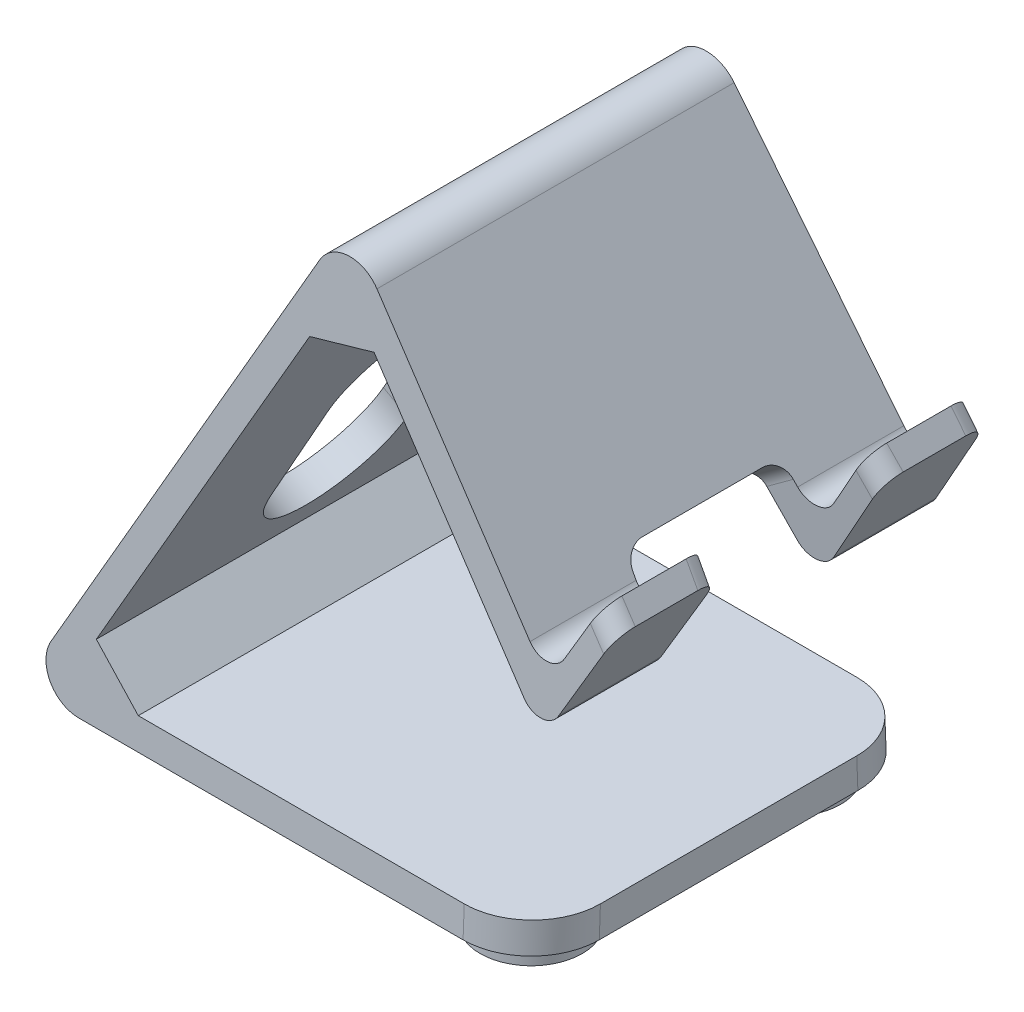
from build123d import *
from OCP.BRepFilletAPI import BRepFilletAPI_MakeChamfer

# Parameters (mm, degrees)
EXTRUDE_1_DEPTH                 = 29
CUT_EXTRUDE_1_DEPTH             = 114.428391508
CUT_EXTRUDE_1_DEPTH_BACK        = 114.428391508
CUT_EXTRUDE_2_REACH             = 120.355
CUT_EXTRUDE_2_DIRECTION_2_DEPTH = 119.355335874
FILLET_2_R                      = 10
CHAMFER_1_SIZE                  = 10
CHAMFER_1_SIZE2                 = 7.55059217
CHAMFER_1_SIZE2_2               = 7.3430239
FILLET_4_R                      = 5
FILLET_5_R                      = 5
FILLET_6_R                      = 3
FILLET_8_R                      = 3
SKETCH_4_R                      = 7.5
EXTRUDE_2_DEPTH                 = 3
CUT_EXTRUDE_3_DEPTH             = 9
CUT_EXTRUDE_4_DEPTH             = 0.3
FILLET_9_R                      = 3


with BuildPart() as part:
    # 草图1 → 凸台-拉伸1 (new, symmetric)
    with BuildSketch(Plane.XY):
        Polygon((0, 0), (-75, 0), (-30, 80), (1, 37.6), (8.5, 50.590381057), (10.565726296, 47.765000574), (0.433642115, 30.215715986), (-30, 71.841084555), (-67.879360062, 4.5), (0, 4.5), align=None)
    extrude(amount=EXTRUDE_1_DEPTH, both=True)

    # 草图2 → 切除-拉伸1 (cut, two sides: drawn at the far end of the back side and taken through both)
    with BuildSketch(Plane(origin=(0, 0, 0), x_dir=(0, 0, -1), z_dir=(1, 0, 0)).offset(-CUT_EXTRUDE_1_DEPTH_BACK)):
        Polygon((-29, 0), (-26, 80), (-29, 80), align=None)
        Polygon((29, 80), (29, 0), (26, 80), align=None)
    extrude(amount=CUT_EXTRUDE_1_DEPTH + CUT_EXTRUDE_1_DEPTH_BACK, mode=Mode.SUBTRACT)

    # 草图3 → 切除-拉伸2 (cut, up to next)
    with BuildSketch(Plane(origin=(18.566022416, 13.574214502, 0), x_dir=(0, 0, -1), z_dir=(0.8072515663768532, 0.5902075131528883, 0)), mode=Mode.PRIVATE) as cut_extrude_2_sk1:
        Polygon((11.5, 38), (-11.5, 38), (-14, 13), (14, 13), align=None)
    cut_extrude_2_tool1 = extrude(cut_extrude_2_sk1.sketch, amount=-CUT_EXTRUDE_2_REACH, mode=Mode.PRIVATE) & part.part
    add(cut_extrude_2_tool1.solids().sort_by_distance((3.756829, 33.82937, 0))[0], mode=Mode.SUBTRACT)

    # 草图3 → 切除-拉伸2 direction 2 (cut)
    with BuildSketch(Plane(origin=(18.566022416, 13.574214502, 0), x_dir=(0, 0, -1), z_dir=(0.8072515663768532, 0.5902075131528883, 0))):
        Polygon((11.5, 38), (-11.5, 38), (-14, 13), (14, 13), align=None)
    extrude(amount=CUT_EXTRUDE_2_DIRECTION_2_DEPTH, mode=Mode.SUBTRACT)

    # 圆角2
    fillet_2_edges = [part.edges().sort_by_distance(p)[0] for p in [
        (0, 2.25, 28.915625),
        (0, 2.25, -28.915625),
    ]]
    fillet(fillet_2_edges, radius=FILLET_2_R)

    # 倒角1: one chamfer whose edges measure the first distance from different faces: ONE call of the kernel's chamfer builder (chamfer() names one face for all edges)
    chamfer_1_edges_1 = [part.edges().sort_by_distance(p)[0] for p in [
        (-30, 71.841084555, 0),
    ]]
    chamfer_1_side_1 = [part.faces().sort_by_distance(p)[0] for p in [
        (-49.228826555, 37.656504012, 0),
    ]]
    chamfer_1_edges_2 = [part.edges().sort_by_distance(p)[0] for p in [
        (-67.879360062, 4.5, 0),
    ]]
    chamfer_1_side_2 = [part.faces().sort_by_distance(p)[0] for p in [
        (-34.291459769, 4.5, 0),
    ]]
    chamfer_1 = BRepFilletAPI_MakeChamfer(part.part.solid().wrapped)
    for e in chamfer_1_edges_1:
        chamfer_1.Add(CHAMFER_1_SIZE, CHAMFER_1_SIZE2, e.wrapped, chamfer_1_side_1[0].wrapped)  # the first distance lies on this face
    for e in chamfer_1_edges_2:
        chamfer_1.Add(CHAMFER_1_SIZE, CHAMFER_1_SIZE2_2, e.wrapped, chamfer_1_side_2[0].wrapped)  # the first distance lies on this face
    add(Compound.cast(chamfer_1.Shape()), mode=Mode.REPLACE)

    # 圆角4
    fillet_4_edges = [part.edges().sort_by_distance(p)[0] for p in [
        (-75, 0, 0),
    ]]
    fillet(fillet_4_edges, radius=FILLET_4_R)

    # 圆角5
    fillet_5_edges = [part.edges().sort_by_distance(p)[0] for p in [
        (-30, 80, 0),
    ]]
    fillet(fillet_5_edges, radius=FILLET_5_R)

    # 圆角6
    fillet_6_edges = [part.edges().sort_by_distance(p)[0] for p in [
        (1, 37.6, 19.956877431),
        (0.433642115, 30.215715986, 20.376668064),
        (1, 37.6, -19.956877431),
        (0.433642115, 30.215715986, -20.376668064),
    ]]
    fillet(fillet_6_edges, radius=FILLET_6_R)

    # 圆角8
    fillet_8_edges = [part.edges().sort_by_distance(p)[0] for p in [
        (9.532863148, 49.177690816, -11.892759951),
        (9.532863148, 49.177690816, 11.892759951),
        (9.532863148, 49.177690816, 27.155836594),
        (9.532863148, 49.177690816, -27.155836594),
    ]]
    fillet(fillet_8_edges, radius=FILLET_8_R)

    # 草图4 → 凸台-拉伸2 (add)
    with BuildSketch(Plane.XZ):
        with Locations(Location((-10, -18.99297122, 0), (0, 0, 90))):
            Circle(SKETCH_4_R)
        with Locations(Location((-60, 0, 0), (0, 0, 149.328001101))):
            Circle(SKETCH_4_R)
        with Locations(Location((-10, 18.99297122, 0), (0, 0, 90))):
            Circle(SKETCH_4_R)
    extrude(amount=EXTRUDE_2_DEPTH)

    # 草图5 → 切除-拉伸3 (cut)
    with BuildSketch(Plane(origin=(-56.973293769, 32.047477745, 0), x_dir=(0, 0, 1), z_dir=(-0.8715755371245493, 0.4902612396325589, 0))):
        with BuildLine():
            Line((10, 9.51443725), (10, -7.598115419))
            ThreePointArc((10, -7.598115419), (0, -17.598115419), (-10, -7.598115419))
            Line((-10, -7.598115419), (-10, 9.51443725))
            ThreePointArc((-10, 9.51443725), (0, 19.51443725), (10, 9.51443725))
        make_face()
    extrude(amount=-CUT_EXTRUDE_3_DEPTH, mode=Mode.SUBTRACT)

    # 草图6 → 切除-拉伸4 (cut)
    # profile 1 of 10: a face of its own
    with BuildSketch(Plane(origin=(-56.973293769, 32.047477745, 0), x_dir=(0, 0, 1), z_dir=(-0.8715755371245493, 0.4902612396325589, 0))):
        with BuildLine():
            Line((-14.585380734, 32.547651873), (-14.27127817, 32.547651873))
            Line((-14.27127817, 32.547651873), (-14.27127817, 32.074394661))
            add(Edge.make_bspline(
                [(-14.27127817, 32.074394661), (-14.237920686, 32.117332395), (-14.173097091, 32.200773288), (-14.061372186, 32.308763416), (-13.943445377, 32.39983872), (-13.816281965, 32.471221253), (-13.681858275, 32.525042065), (-13.540725957, 32.564821515), (-13.391687193, 32.588262989), (-13.28979074, 32.591084651), (-13.237824644, 32.592523667)],
                knots=[0, 0, 0, 0, 1.0828784, 2.104357462, 3.088488658, 4.04616522, 5.001424249, 5.969181776, 6.964304535, 8, 8, 8, 8], degree=3))
            add(Edge.make_bspline(
                [(-13.237824644, 32.592523667), (-13.192433041, 32.591210488), (-13.102714153, 32.588614921), (-12.970650924, 32.571041867), (-12.84347554, 32.540924174), (-12.721907486, 32.497523259), (-12.604644421, 32.443867789), (-12.493422321, 32.376150754), (-12.386508766, 32.297744563), (-12.286592577, 32.207512412), (-12.194271209, 32.109884146), (-12.114425028, 32.004861841), (-12.045553124, 31.895899255), (-11.989882827, 31.781307163), (-11.94627448, 31.661987933), (-11.915259802, 31.537459492), (-11.896802159, 31.408183552), (-11.894325707, 31.320280831), (-11.893073042, 31.275816937)],
                knots=[0, 0, 0, 0, 1.041296284, 2.058176809, 3.050446431, 4.034000596, 5.01514041, 6.003636468, 7.015969324, 8.052561599, 9.08815499, 10.094063707, 11.074456064, 12.040834395, 13.011057502, 13.983766392, 14.980127149, 16, 16, 16, 16], degree=3))
            add(Edge.make_bspline(
                [(-11.893073042, 31.275816937), (-11.894298527, 31.230414628), (-11.896715362, 31.140874724), (-11.915460368, 31.009387626), (-11.945417242, 30.882900253), (-11.988475425, 30.761622989), (-12.044116913, 30.645639338), (-12.111821474, 30.535032942), (-12.191707941, 30.429839238), (-12.283009068, 30.331486338), (-12.382062004, 30.240887025), (-12.487939494, 30.161648956), (-12.598998419, 30.095107581), (-12.714670587, 30.039524621), (-12.835946225, 29.997632437), (-12.962259503, 29.967414636), (-13.093541649, 29.948780141), (-13.182842801, 29.946327998), (-13.228008939, 29.94508777)],
                knots=[0, 0, 0, 0, 1.038740735, 2.04854663, 3.033179607, 4.009277356, 4.987731542, 5.972001279, 6.972200261, 8.005528982, 9.039189865, 10.040446548, 11.026516639, 11.997840187, 12.972163198, 13.956796175, 14.96660207, 16, 16, 16, 16], degree=3))
            add(Edge.make_bspline(
                [(-13.228008939, 29.94508777), (-13.278836511, 29.946382578), (-13.379235867, 29.948940203), (-13.526033538, 29.974859613), (-13.667310389, 30.013596548), (-13.801501214, 30.070295542), (-13.929669027, 30.142551058), (-14.051088832, 30.230661264), (-14.166405585, 30.334441888), (-14.235814343, 30.413173705), (-14.27127817, 30.453401071)],
                knots=[0, 0, 0, 0, 1.014726462, 2.004382257, 2.969841629, 3.936926163, 4.907207904, 5.903978561, 6.929055279, 8, 8, 8, 8], degree=3))
            Line((-14.27127817, 30.453401071), (-14.27127817, 29.047651873))
            Line((-14.27127817, 29.047651873), (-14.585380734, 29.047651873))
            Line((-14.585380734, 29.047651873), (-14.585380734, 32.547651873))
        make_face()
        with BuildLine():
            add(Edge.make_bspline(
                [(-13.240629131, 32.278421103), (-13.276208694, 32.277780845), (-13.346255682, 32.276520342), (-13.448927901, 32.261546393), (-13.547823328, 32.239808652), (-13.64194528, 32.206896751), (-13.732195896, 32.166497938), (-13.817880061, 32.116015927), (-13.898937629, 32.056363921), (-13.975164659, 31.988684577), (-14.044027952, 31.914109889), (-14.10499088, 31.83452208), (-14.156198186, 31.75002194), (-14.198700206, 31.661396578), (-14.231043488, 31.567951293), (-14.253999208, 31.47021828), (-14.268429561, 31.368090568), (-14.270318498, 31.298534561), (-14.27127817, 31.263196744)],
                knots=[0, 0, 0, 0, 1.05670511, 2.080379991, 3.077984906, 4.06214886, 5.038337365, 6.01289324, 7.01187578, 8.025460281, 9.038092164, 10.024533457, 11.000252242, 11.969694649, 12.940728589, 13.933144304, 14.949937299, 16, 16, 16, 16], degree=3))
            add(Edge.make_bspline(
                [(-14.27127817, 31.263196744), (-14.269687314, 31.216808632), (-14.266570692, 31.125930391), (-14.241233324, 30.993146269), (-14.19999806, 30.867494613), (-14.141469346, 30.750033576), (-14.067521772, 30.642050741), (-13.978423616, 30.545360135), (-13.874981065, 30.460569544), (-13.758913873, 30.38914829), (-13.634491742, 30.331160223), (-13.50470583, 30.289646013), (-13.371340949, 30.264073785), (-13.28117263, 30.260826966), (-13.235721279, 30.259190334)],
                knots=[0, 0, 0, 0, 1.03728447, 2.032128127, 3.01272805, 3.987917167, 4.958271349, 5.931593992, 6.91984656, 7.941419022, 8.973179163, 9.983609215, 10.983593296, 12, 12, 12, 12], degree=3))
            add(Edge.make_bspline(
                [(-13.235721279, 30.259190334), (-13.191185511, 30.260746711), (-13.102790018, 30.263835839), (-12.972631896, 30.290574027), (-12.846141258, 30.331419051), (-12.725961086, 30.390978608), (-12.613137598, 30.463968666), (-12.511256044, 30.551528699), (-12.422249131, 30.653018642), (-12.346384776, 30.766027145), (-12.28525329, 30.887202529), (-12.23932305, 31.012583917), (-12.212814477, 31.14172934), (-12.209057689, 31.228727053), (-12.207175606, 31.272311328)],
                knots=[0, 0, 0, 0, 1.00104056, 1.986885549, 2.97790532, 3.984399681, 4.995088187, 5.994304198, 6.996462723, 8.023150851, 9.048424203, 10.043036403, 11.019596776, 12, 12, 12, 12], degree=3))
            add(Edge.make_bspline(
                [(-12.207175606, 31.272311328), (-12.20863034, 31.316166317), (-12.211528473, 31.40353462), (-12.240075511, 31.532297523), (-12.282975489, 31.6581855), (-12.345534541, 31.777706049), (-12.41973581, 31.890480132), (-12.509482807, 31.990034011), (-12.610099004, 32.077204684), (-12.722788168, 32.149220093), (-12.843728593, 32.206505588), (-12.971043509, 32.248389227), (-13.104087111, 32.273562977), (-13.194714766, 32.276787483), (-13.240629131, 32.278421103)],
                knots=[0, 0, 0, 0, 0.983928682, 1.960191568, 2.949917689, 3.96440592, 4.982380491, 5.975291189, 6.965713506, 7.964880129, 8.970154049, 9.96478489, 10.968906225, 12, 12, 12, 12], degree=3))
        make_face(mode=Mode.SUBTRACT)
    # profile 2 of 10: a face of its own
    with BuildSketch(Plane(origin=(-56.973293769, 32.047477745, 0), x_dir=(0, 0, 1), z_dir=(-0.8715755371245493, 0.4902612396325589, 0))):
        with BuildLine():
            Line((-11.264867913, 33.579703155), (-10.950765349, 33.579703155))
            Line((-10.950765349, 33.579703155), (-10.950765349, 32.064578956))
            add(Edge.make_bspline(
                [(-10.950765349, 32.064578956), (-10.917048048, 32.106722938), (-10.851398734, 32.188779431), (-10.740902617, 32.295840621), (-10.627431745, 32.388639243), (-10.507066935, 32.4625097), (-10.382016415, 32.520866243), (-10.25175277, 32.56225389), (-10.116251799, 32.587704986), (-10.024226649, 32.590903404), (-9.977608298, 32.592523667)],
                knots=[0, 0, 0, 0, 1.125788106, 2.19196713, 3.20547328, 4.180437432, 5.132270164, 6.079753143, 7.027236121, 8, 8, 8, 8], degree=3))
            add(Edge.make_bspline(
                [(-9.977608298, 32.592523667), (-9.930277905, 32.590778237), (-9.83764091, 32.587362009), (-9.702759447, 32.560348628), (-9.576798572, 32.51419119), (-9.460132729, 32.451024165), (-9.355308032, 32.372351338), (-9.262458268, 32.281519815), (-9.186617469, 32.176245897), (-9.135018352, 32.078989643), (-9.101444944, 31.992450889), (-9.080193118, 31.918214377), (-9.06217392, 31.835492463), (-9.046474184, 31.744327731), (-9.036010602, 31.64428256), (-9.027605984, 31.535808305), (-9.02162953, 31.418911187), (-9.021397926, 31.337990938), (-9.02127817, 31.296149469)],
                knots=[0, 0, 0, 0, 1.235656852, 2.418478516, 3.575258207, 4.727955599, 5.870717718, 6.98870536, 8.107142894, 9.245821548, 9.854588956, 10.528768408, 11.260415777, 12.065282286, 12.943670737, 13.886611085, 14.907229059, 16, 16, 16, 16], degree=3))
            Line((-9.02127817, 31.296149469), (-9.02127817, 29.989959565))
            Line((-9.02127817, 29.989959565), (-9.335380734, 29.989959565))
            Line((-9.335380734, 29.989959565), (-9.335380734, 31.193084565))
            add(Edge.make_bspline(
                [(-9.335380734, 31.193084565), (-9.335571037, 31.227907234), (-9.335935055, 31.294517075), (-9.337138399, 31.389883183), (-9.339824615, 31.476379318), (-9.34416544, 31.553728269), (-9.348730748, 31.622037873), (-9.355014065, 31.681208927), (-9.362324299, 31.731322703), (-9.36889308, 31.761487331), (-9.371839067, 31.775015655)],
                knots=[0, 0, 0, 0, 1.430932559, 2.737130458, 3.918967929, 4.986496826, 5.920444988, 6.731744033, 7.431208747, 8, 8, 8, 8], degree=3))
            add(Edge.make_bspline(
                [(-9.371839067, 31.775015655), (-9.383263312, 31.814709918), (-9.405226357, 31.891021909), (-9.456274334, 31.994684319), (-9.520033345, 32.08306906), (-9.597880607, 32.154983348), (-9.688438971, 32.211394887), (-9.792298935, 32.250462669), (-9.908483004, 32.274710391), (-9.990334475, 32.277149695), (-10.03299692, 32.278421103)],
                knots=[0, 0, 0, 0, 1.090059168, 2.095632401, 3.037101401, 3.955032261, 4.878929692, 5.839099886, 6.873700383, 8, 8, 8, 8], degree=3))
            add(Edge.make_bspline(
                [(-10.03299692, 32.278421103), (-10.058264693, 32.277945277), (-10.108268963, 32.277003629), (-10.182417629, 32.26754973), (-10.254346693, 32.252101012), (-10.324748871, 32.231196473), (-10.392132068, 32.202750937), (-10.458460393, 32.169820747), (-10.521854602, 32.129512492), (-10.583440419, 32.084286725), (-10.640757952, 32.034216965), (-10.694085068, 31.98137001), (-10.741623408, 31.925095046), (-10.784691999, 31.86629493), (-10.821870285, 31.804163136), (-10.854323367, 31.739298818), (-10.881859063, 31.671616672), (-10.895541755, 31.624641611), (-10.902387946, 31.601137449)],
                knots=[0, 0, 0, 0, 1.024319606, 2.027102035, 3.025350316, 4.005802111, 5.00026367, 5.987881639, 7.005602596, 8.042517216, 9.083927026, 10.089214625, 11.084353441, 12.06828073, 13.041928858, 14.016821737, 15.00770877, 16, 16, 16, 16], degree=3))
            add(Edge.make_bspline(
                [(-10.902387946, 31.601137449), (-10.906327373, 31.584116499), (-10.91491187, 31.547025751), (-10.924226703, 31.485851428), (-10.9325645, 31.414765056), (-10.939613049, 31.333874455), (-10.943936136, 31.242883213), (-10.948594376, 31.142412254), (-10.95032839, 31.031832233), (-10.950615343, 30.954936726), (-10.950765349, 30.914739212)],
                knots=[0, 0, 0, 0, 0.607992626, 1.324890765, 2.152360218, 3.099583803, 4.150613268, 5.323148443, 6.60066238, 8, 8, 8, 8], degree=3))
            Line((-10.950765349, 30.914739212), (-10.950765349, 29.989959565))
            Line((-10.950765349, 29.989959565), (-11.264867913, 29.989959565))
            Line((-11.264867913, 29.989959565), (-11.264867913, 33.579703155))
        make_face()
    # profile 3 of 10: a face of its own
    with BuildSketch(Plane(origin=(-56.973293769, 32.047477745, 0), x_dir=(0, 0, 1), z_dir=(-0.8715755371245493, 0.4902612396325589, 0))):
        with BuildLine():
            add(Edge.make_bspline(
                [(-7.067952849, 32.592523667), (-7.019961577, 32.591501776), (-6.925862419, 32.589498097), (-6.788054533, 32.568083132), (-6.656509397, 32.535335767), (-6.530723205, 32.490064205), (-6.41230691, 32.429382255), (-6.299535665, 32.356972964), (-6.192718657, 32.27119037), (-6.128695627, 32.204832302), (-6.096198042, 32.171149469)],
                knots=[0, 0, 0, 0, 1.054011418, 2.066658804, 3.057071809, 4.030435133, 4.997543892, 5.974964718, 6.972108034, 8, 8, 8, 8], degree=3))
            add(Edge.make_bspline(
                [(-6.096198042, 32.171149469), (-6.068216088, 32.138935483), (-6.012793707, 32.075130941), (-5.941727989, 31.971675328), (-5.880506428, 31.864535227), (-5.831443467, 31.7522879), (-5.792758444, 31.635913229), (-5.765292748, 31.515011218), (-5.748955813, 31.389848871), (-5.746752846, 31.304845033), (-5.745637144, 31.261794501)],
                knots=[0, 0, 0, 0, 1.025258237, 2.030674902, 3.01204498, 3.988269485, 4.97094183, 5.956517959, 6.965070386, 8, 8, 8, 8], degree=3))
            add(Edge.make_bspline(
                [(-5.745637144, 31.261794501), (-5.746618482, 31.218494443), (-5.74855765, 31.13293151), (-5.766901266, 31.006912144), (-5.795432352, 30.884717321), (-5.83626419, 30.766858627), (-5.8886223, 30.6529758), (-5.952512987, 30.543566251), (-6.028384604, 30.438414118), (-6.114388601, 30.338412279), (-6.209440477, 30.246246064), (-6.312556626, 30.165917795), (-6.421710659, 30.097096271), (-6.538354013, 30.041659855), (-6.661421499, 29.997950155), (-6.791178567, 29.967250138), (-6.927423638, 29.948688454), (-7.020450859, 29.946304881), (-7.067952849, 29.94508777)],
                knots=[0, 0, 0, 0, 0.998656419, 1.973391657, 2.932242238, 3.890759089, 4.846373663, 5.82037756, 6.809684879, 7.83454468, 8.860553229, 9.859544525, 10.845671541, 11.83227036, 12.833544569, 13.85385346, 14.904124723, 16, 16, 16, 16], degree=3))
            add(Edge.make_bspline(
                [(-7.067952849, 29.94508777), (-7.115687569, 29.946308966), (-7.209178429, 29.948700741), (-7.345904411, 29.967178023), (-7.475894029, 29.997936006), (-7.599122628, 30.041803499), (-7.716267475, 30.097098042), (-7.826053972, 30.165709732), (-7.929253887, 30.246269887), (-8.024325872, 30.338405824), (-8.110324477, 30.438415781), (-8.186197486, 30.543565819), (-8.250087812, 30.652975913), (-8.302446016, 30.766858598), (-8.343277828, 30.884717329), (-8.371808921, 31.006912142), (-8.390152536, 31.13293151), (-8.392091704, 31.218494443), (-8.393073042, 31.261794501)],
                knots=[0, 0, 0, 0, 1.099876186, 2.154163076, 3.173186993, 4.173200201, 5.163417411, 6.152872554, 7.150605724, 8.17532212, 9.198891216, 10.186952605, 11.159729845, 12.11414092, 13.071450619, 14.029093627, 15.002601286, 16, 16, 16, 16], degree=3))
            add(Edge.make_bspline(
                [(-8.393073042, 31.261794501), (-8.391949731, 31.304611047), (-8.38972577, 31.389380449), (-8.373405261, 31.51430751), (-8.346046704, 31.635004899), (-8.307315308, 31.750930375), (-8.257800117, 31.862685811), (-8.197438829, 31.970090642), (-8.125648197, 32.073078442), (-8.070446245, 32.136800522), (-8.042512144, 32.169046103)],
                knots=[0, 0, 0, 0, 1.031353054, 2.041901799, 3.029428768, 4.008703097, 4.981709435, 5.96992636, 6.972712378, 8, 8, 8, 8], degree=3))
            add(Edge.make_bspline(
                [(-8.042512144, 32.169046103), (-8.010063553, 32.203021043), (-7.946247689, 32.269838739), (-7.838898962, 32.355371263), (-7.726405141, 32.429287337), (-7.606680214, 32.488763552), (-7.480997356, 32.53560207), (-7.348778114, 32.568167585), (-7.210502598, 32.58942094), (-7.115942977, 32.591479118), (-7.067952849, 32.592523667)],
                knots=[0, 0, 0, 0, 1.027980169, 2.021703884, 2.998553061, 3.971491411, 4.943284454, 5.930300938, 6.949603206, 8, 8, 8, 8], degree=3))
        make_face()
        with BuildLine():
            add(Edge.make_bspline(
                [(-7.069355093, 32.278421103), (-7.103292704, 32.277456512), (-7.170291833, 32.275552229), (-7.268911418, 32.261068324), (-7.363851572, 32.23812082), (-7.455292416, 32.205516764), (-7.542925588, 32.163417865), (-7.626834991, 32.111709505), (-7.70726743, 32.051076548), (-7.782649494, 31.981613877), (-7.851831806, 31.905734882), (-7.912309783, 31.824886523), (-7.963734889, 31.740380177), (-8.006575048, 31.652127966), (-8.038482236, 31.559235552), (-8.061655258, 31.462754921), (-8.076125499, 31.362489504), (-8.078011878, 31.294328486), (-8.078970478, 31.259691135)],
                knots=[0, 0, 0, 0, 1.021534396, 2.016698045, 2.994645724, 3.958388632, 4.93408049, 5.916473867, 6.921342795, 7.962252576, 8.998418191, 10.008913653, 10.997312074, 11.973003931, 12.956656626, 13.948281152, 14.957379055, 16, 16, 16, 16], degree=3))
            add(Edge.make_bspline(
                [(-8.078970478, 31.259691135), (-8.077363654, 31.214939108), (-8.07417441, 31.126114703), (-8.048239173, 30.99530358), (-8.004852893, 30.869721728), (-7.946265613, 30.750105342), (-7.872859395, 30.639433064), (-7.786372328, 30.540761579), (-7.687732628, 30.455575768), (-7.578116128, 30.384894922), (-7.45976181, 30.328735167), (-7.334505489, 30.288936191), (-7.203864794, 30.263064499), (-7.114584063, 30.260493024), (-7.069355093, 30.259190334)],
                knots=[0, 0, 0, 0, 1.016792936, 2.018143844, 3.017858371, 4.030088057, 5.03801393, 6.028138512, 7.003788237, 7.991172063, 8.984598303, 9.972568034, 10.972917682, 12, 12, 12, 12], degree=3))
            add(Edge.make_bspline(
                [(-7.069355093, 30.259190334), (-7.024128724, 30.260500614), (-6.934853128, 30.263087071), (-6.804393951, 30.288805891), (-6.679479979, 30.328909552), (-6.561248592, 30.384831761), (-6.451681988, 30.455844176), (-6.352332867, 30.540280553), (-6.266584256, 30.639694405), (-6.193250651, 30.750251933), (-6.133703908, 30.869536286), (-6.090520707, 30.995326758), (-6.064523121, 31.1261088), (-6.061342292, 31.214937131), (-6.059739708, 31.259691135)],
                knots=[0, 0, 0, 0, 1.02726834, 2.027799167, 3.010890988, 4.004497153, 4.992059811, 5.971914811, 6.958719428, 7.966827853, 8.981595046, 9.981490638, 10.983022906, 12, 12, 12, 12], degree=3))
            add(Edge.make_bspline(
                [(-6.059739708, 31.259691135), (-6.060697978, 31.294328693), (-6.062583708, 31.362490119), (-6.077058672, 31.462752572), (-6.100214212, 31.559244169), (-6.132185829, 31.652096172), (-6.174839843, 31.740608677), (-6.227256636, 31.824638404), (-6.287487661, 31.90601495), (-6.357504782, 31.98136859), (-6.43280816, 32.051103627), (-6.513273198, 32.111733016), (-6.597058177, 32.163190612), (-6.684436759, 32.205876852), (-6.775889327, 32.237824193), (-6.870696456, 32.261200824), (-6.968895266, 32.275491021), (-7.035654309, 32.277438162), (-7.069355093, 32.278421103)],
                knots=[0, 0, 0, 0, 1.042956736, 2.052379634, 3.044323526, 4.02829302, 5.004299113, 5.996692471, 7.007513377, 8.048758398, 9.090003419, 10.095195979, 11.07790575, 12.047570684, 13.018257071, 13.989683339, 14.985167495, 16, 16, 16, 16], degree=3))
        make_face(mode=Mode.SUBTRACT)
    # profile 4 of 10: a face of its own
    with BuildSketch(Plane(origin=(-56.973293769, 32.047477745, 0), x_dir=(0, 0, 1), z_dir=(-0.8715755371245493, 0.4902612396325589, 0))):
        with BuildLine():
            Line((-5.117432016, 32.547651873), (-4.803329452, 32.547651873))
            Line((-4.803329452, 32.547651873), (-4.803329452, 32.086313731))
            add(Edge.make_bspline(
                [(-4.803329452, 32.086313731), (-4.769791817, 32.128156454), (-4.704710866, 32.209353718), (-4.596326532, 32.316074292), (-4.481782632, 32.404019517), (-4.361780629, 32.474123311), (-4.236157619, 32.526969938), (-4.105679349, 32.565135869), (-3.969564643, 32.588020697), (-3.877000206, 32.591010927), (-3.830172401, 32.592523667)],
                knots=[0, 0, 0, 0, 1.12780773, 2.188550248, 3.19190651, 4.159438251, 5.104880172, 6.052711206, 7.014878035, 8, 8, 8, 8], degree=3))
            add(Edge.make_bspline(
                [(-3.830172401, 32.592523667), (-3.782841767, 32.590778472), (-3.690204299, 32.587362704), (-3.555326237, 32.560346012), (-3.429352844, 32.514200757), (-3.312733288, 32.450988687), (-3.207606075, 32.372382213), (-3.115281223, 32.280804432), (-3.038917976, 32.175468348), (-2.987720613, 32.077745192), (-2.953994965, 31.991056398), (-2.932762628, 31.916809648), (-2.914731646, 31.834091497), (-2.899099898, 31.743151908), (-2.888522786, 31.643353717), (-2.880180495, 31.535106025), (-2.8742018, 31.418443895), (-2.873964593, 31.337757267), (-2.873842272, 31.296149469)],
                knots=[0, 0, 0, 0, 1.235846778, 2.418850247, 3.575807741, 4.728682307, 5.871620074, 6.994088408, 8.11269785, 9.256955736, 9.865816715, 10.540099792, 11.271859618, 12.076849838, 12.949306005, 13.892391288, 14.913166135, 16, 16, 16, 16], degree=3))
            Line((-2.873842272, 31.296149469), (-2.873842272, 29.989959565))
            Line((-2.873842272, 29.989959565), (-3.187944837, 29.989959565))
            Line((-3.187944837, 29.989959565), (-3.187944837, 31.193084565))
            add(Edge.make_bspline(
                [(-3.187944837, 31.193084565), (-3.188138045, 31.22790701), (-3.188507619, 31.294516421), (-3.189673265, 31.389885444), (-3.192483072, 31.476372022), (-3.196431385, 31.55376939), (-3.202210415, 31.622003226), (-3.208233047, 31.681212503), (-3.215598024, 31.731322045), (-3.222160937, 31.761487128), (-3.225104292, 31.775015655)],
                knots=[0, 0, 0, 0, 1.430800155, 2.736877192, 3.918605307, 4.986035426, 5.920637409, 6.731861385, 7.431261377, 8, 8, 8, 8], degree=3))
            add(Edge.make_bspline(
                [(-3.225104292, 31.775015655), (-3.235729823, 31.81472684), (-3.256180684, 31.891158584), (-3.306714667, 31.994832937), (-3.370528848, 32.083031125), (-3.448426697, 32.155207846), (-3.539655773, 32.211378683), (-3.643962916, 32.250352638), (-3.760341556, 32.274728907), (-3.842195939, 32.277156039), (-3.884859901, 32.278421103)],
                knots=[0, 0, 0, 0, 1.084156227, 2.086665306, 3.027808233, 3.945421172, 4.874247719, 5.839848303, 6.874090471, 8, 8, 8, 8], degree=3))
            add(Edge.make_bspline(
                [(-3.884859901, 32.278421103), (-3.910127584, 32.277945099), (-3.960131677, 32.277003098), (-4.034281649, 32.2675518), (-4.106205822, 32.252093344), (-4.176626031, 32.231224707), (-4.244133825, 32.202562437), (-4.310898116, 32.170033067), (-4.37440488, 32.129484855), (-4.436008278, 32.084294234), (-4.493321085, 32.034215027), (-4.546649424, 31.981370516), (-4.594187444, 31.925094913), (-4.637256119, 31.866294965), (-4.674434383, 31.804163127), (-4.706887471, 31.739298821), (-4.734423165, 31.671616672), (-4.748105858, 31.62464161), (-4.754952048, 31.601137449)],
                knots=[0, 0, 0, 0, 1.023777757, 2.026029729, 3.023749952, 4.003683103, 4.997618607, 5.993177895, 7.010360494, 8.046726602, 9.087585522, 10.09234134, 11.086953743, 12.070360549, 13.043493632, 14.017870808, 15.008233677, 16, 16, 16, 16], degree=3))
            add(Edge.make_bspline(
                [(-4.754952048, 31.601137449), (-4.758891697, 31.583882246), (-4.767468106, 31.546318572), (-4.776731285, 31.484674153), (-4.785138861, 31.413364178), (-4.792175819, 31.332471861), (-4.796481236, 31.241713985), (-4.801175633, 31.141478148), (-4.802884694, 31.031364659), (-4.803177048, 30.954702967), (-4.803329452, 30.914739212)],
                knots=[0, 0, 0, 0, 0.615963638, 1.340920617, 2.168419149, 3.115676021, 4.16674242, 5.331190069, 6.6087489, 8, 8, 8, 8], degree=3))
            Line((-4.803329452, 30.914739212), (-4.803329452, 29.989959565))
            Line((-4.803329452, 29.989959565), (-5.117432016, 29.989959565))
            Line((-5.117432016, 29.989959565), (-5.117432016, 32.547651873))
        make_face()
    # profile 5 of 10: a face of its own
    with BuildSketch(Plane(origin=(-56.973293769, 32.047477745, 0), x_dir=(0, 0, 1), z_dir=(-0.8715755371245493, 0.4902612396325589, 0))):
        with BuildLine():
            Line((-0.056734901, 30.797651873), (0.222311574, 30.651117417))
            add(Edge.make_bspline(
                [(0.222311574, 30.651117417), (0.200074978, 30.611674086), (0.15681137, 30.534932983), (0.082410622, 30.429501123), (0.004418549, 30.334653407), (-0.080685419, 30.252923753), (-0.170355097, 30.181672368), (-0.265087752, 30.119334543), (-0.36537657, 30.066216023), (-0.471226295, 30.021463495), (-0.583525846, 29.987054001), (-0.702547362, 29.96274978), (-0.828518858, 29.947726511), (-0.914865038, 29.94598137), (-0.959078651, 29.94508777)],
                knots=[0, 0, 0, 0, 1.120438281, 2.179929193, 3.190490725, 4.156257408, 5.095198341, 6.022838206, 6.959905092, 7.901321166, 8.864066838, 9.862729781, 10.905609505, 12, 12, 12, 12], degree=3))
            add(Edge.make_bspline(
                [(-0.959078651, 29.94508777), (-1.008220628, 29.946234945), (-1.10408239, 29.948472752), (-1.243622137, 29.967765216), (-1.375001555, 29.999237575), (-1.498213259, 30.043203117), (-1.612955511, 30.100630441), (-1.719456366, 30.170589923), (-1.818275892, 30.252722177), (-1.906300101, 30.347738621), (-1.985543984, 30.449420578), (-2.055469804, 30.555376462), (-2.113927235, 30.665339687), (-2.161479845, 30.778610211), (-2.19988471, 30.894474105), (-2.226651414, 31.013985572), (-2.242081162, 31.136821156), (-2.244445607, 31.219918492), (-2.245637144, 31.261794501)],
                knots=[0, 0, 0, 0, 1.145258523, 2.234067595, 3.276747158, 4.290159414, 5.277019952, 6.260822364, 7.254936242, 8.264827045, 9.274100331, 10.257902744, 11.220704747, 12.172965371, 13.118907548, 14.062713208, 15.023725156, 16, 16, 16, 16], degree=3))
            add(Edge.make_bspline(
                [(-2.245637144, 31.261794501), (-2.244578003, 31.301089331), (-2.242478925, 31.378966496), (-2.229248137, 31.49423204), (-2.205799844, 31.606260493), (-2.17362352, 31.715144941), (-2.132072274, 31.820703075), (-2.081240055, 31.922999138), (-2.021047677, 32.021924278), (-1.974575003, 32.084327412), (-1.95116599, 32.115760847)],
                knots=[0, 0, 0, 0, 1.024358464, 2.0301432, 3.019427413, 4.004406732, 4.986367066, 5.972626655, 6.978780325, 8, 8, 8, 8], degree=3))
            add(Edge.make_bspline(
                [(-1.95116599, 32.115760847), (-1.919458308, 32.153629717), (-1.857047361, 32.228167867), (-1.751491006, 32.326106193), (-1.637190809, 32.408149968), (-1.515579183, 32.476157105), (-1.385242709, 32.527830752), (-1.247933418, 32.566338334), (-1.102087832, 32.587916345), (-1.002382611, 32.590964178), (-0.951366311, 32.592523667)],
                knots=[0, 0, 0, 0, 1.030682036, 2.02871468, 2.997146059, 3.962720338, 4.930598197, 5.918074684, 6.934738563, 8, 8, 8, 8], degree=3))
            add(Edge.make_bspline(
                [(-0.951366311, 32.592523667), (-0.898918706, 32.591169618), (-0.79602846, 32.588513283), (-0.645996339, 32.56388695), (-0.504035622, 32.524834395), (-0.370203118, 32.469680605), (-0.244485257, 32.398521053), (-0.127699207, 32.310379211), (-0.017847695, 32.207961124), (0.046060884, 32.129197915), (0.078581606, 32.089118219)],
                knots=[0, 0, 0, 0, 1.056321875, 2.072262726, 3.055038591, 4.01806755, 4.982017516, 5.957941055, 6.960871419, 8, 8, 8, 8], degree=3))
            add(Edge.make_bspline(
                [(0.078581606, 32.089118219), (0.100708544, 32.058914637), (0.144815137, 31.998708519), (0.200062237, 31.900537361), (0.248019632, 31.797826767), (0.286352593, 31.68891647), (0.317392094, 31.57509689), (0.339848913, 31.455554345), (0.353018532, 31.330324434), (0.355607229, 31.244997878), (0.356926958, 31.201498026)],
                knots=[0, 0, 0, 0, 0.94817472, 1.890038105, 2.849395472, 3.817997239, 4.812318967, 5.836947057, 6.897266129, 8, 8, 8, 8], degree=3))
            Line((0.356926958, 31.201498026), (-1.93153458, 31.201498026))
            add(Edge.make_bspline(
                [(-1.93153458, 31.201498026), (-1.929994974, 31.167797562), (-1.9269674, 31.101526958), (-1.912852257, 31.004556175), (-1.890603483, 30.912182833), (-1.85933442, 30.825099791), (-1.821467575, 30.742169664), (-1.775081858, 30.664007627), (-1.719742304, 30.590969697), (-1.658016605, 30.522402559), (-1.589309509, 30.461341798), (-1.517026762, 30.406690022), (-1.440133197, 30.360884425), (-1.359235114, 30.323704535), (-1.274463329, 30.294598219), (-1.185791134, 30.274730398), (-1.093393017, 30.261423292), (-1.030407283, 30.259943626), (-0.998341471, 30.259190334)],
                knots=[0, 0, 0, 0, 1.094153842, 2.151609401, 3.174256925, 4.172055639, 5.149267565, 6.128595816, 7.11444997, 8.118368179, 9.117203808, 10.09244225, 11.054858984, 12.015122123, 12.976791628, 13.957293641, 14.960065497, 16, 16, 16, 16], degree=3))
            add(Edge.make_bspline(
                [(-0.998341471, 30.259190334), (-0.966990324, 30.259798391), (-0.904783633, 30.261004892), (-0.812142775, 30.272736803), (-0.721003248, 30.291707078), (-0.631742265, 30.317597068), (-0.546171419, 30.34917392), (-0.466925869, 30.387276778), (-0.394045653, 30.429426525), (-0.325928686, 30.4776362), (-0.259857693, 30.536644387), (-0.194315207, 30.610280108), (-0.124038553, 30.697367636), (-0.080048961, 30.762913302), (-0.056734901, 30.797651873)],
                knots=[0, 0, 0, 0, 0.99110716, 1.966546729, 2.947904876, 3.932708344, 4.903319531, 5.828989031, 6.710028674, 7.56322171, 8.463672341, 9.504779593, 10.677557249, 12, 12, 12, 12], degree=3))
        make_face()
        with BuildLine():
            add(Edge.make_bspline(
                [(0.042824394, 31.51560059), (0.03132777, 31.557263464), (0.009200468, 31.637451085), (-0.037035896, 31.748491975), (-0.089107437, 31.847179876), (-0.150729168, 31.932759509), (-0.220547894, 32.008763022), (-0.301193077, 32.075181607), (-0.39162897, 32.134599058), (-0.491388111, 32.184751558), (-0.597029896, 32.227441417), (-0.707636088, 32.256066532), (-0.820493876, 32.275676075), (-0.896828162, 32.277502183), (-0.93524051, 32.278421103)],
                knots=[0, 0, 0, 0, 1.154881502, 2.222775134, 3.210006277, 4.132804581, 5.035138423, 5.962687519, 6.919655026, 7.923214229, 8.944639381, 9.960483929, 10.97369054, 12, 12, 12, 12], degree=3))
            add(Edge.make_bspline(
                [(-0.93524051, 32.278421103), (-0.966589948, 32.277809432), (-1.028561197, 32.276600286), (-1.119862265, 32.265130156), (-1.207541964, 32.246170311), (-1.292247252, 32.220205355), (-1.37286812, 32.185596752), (-1.451062889, 32.145013526), (-1.524843285, 32.095471942), (-1.57098458, 32.057713087), (-1.594294997, 32.038637449)],
                knots=[0, 0, 0, 0, 1.04873581, 2.073130211, 3.073294108, 4.04793562, 5.032784715, 6.005352987, 6.992311501, 8, 8, 8, 8], degree=3))
            add(Edge.make_bspline(
                [(-1.594294997, 32.038637449), (-1.610988279, 32.023543134), (-1.644771413, 31.992995918), (-1.689911935, 31.940366711), (-1.733132407, 31.883615149), (-1.77246606, 31.820570024), (-1.808543646, 31.751949245), (-1.842303624, 31.67833161), (-1.872690036, 31.59915848), (-1.889786146, 31.543986041), (-1.898581856, 31.51560059)],
                knots=[0, 0, 0, 0, 0.879870761, 1.780643979, 2.707998968, 3.669668524, 4.684282772, 5.740141944, 6.837334558, 8, 8, 8, 8], degree=3))
            Line((-1.898581856, 31.51560059), (0.042824394, 31.51560059))
        make_face(mode=Mode.SUBTRACT)
    # profile 6 of 10: a face of its own
    with BuildSketch(Plane(origin=(-56.973293769, 32.047477745, 0), x_dir=(0, 0, 1), z_dir=(-0.8715755371245493, 0.4902612396325589, 0))):
        with BuildLine():
            Line((3.542824394, 32.228641456), (3.329683369, 32.009190334))
            add(Edge.make_bspline(
                [(3.329683369, 32.009190334), (3.311292865, 32.03050348), (3.275838139, 32.071592717), (3.219606658, 32.126529784), (3.163583055, 32.172666723), (3.108534241, 32.211618982), (3.053075972, 32.241068128), (2.997859054, 32.26256299), (2.942826315, 32.275864796), (2.90604028, 32.277579235), (2.887976638, 32.278421103)],
                knots=[0, 0, 0, 0, 1.26578478, 2.440284043, 3.530471711, 4.527705817, 5.468200915, 6.346673037, 7.188140097, 8, 8, 8, 8], degree=3))
            add(Edge.make_bspline(
                [(2.887976638, 32.278421103), (2.865837248, 32.27734623), (2.822270062, 32.275231032), (2.759844244, 32.254117602), (2.701893619, 32.221708864), (2.651736639, 32.17574028), (2.609248959, 32.122976011), (2.578235278, 32.063979686), (2.559269294, 32.000531643), (2.556864562, 31.956501785), (2.555644907, 31.934170302)],
                knots=[0, 0, 0, 0, 0.99966794, 1.967205029, 2.953328237, 3.988086729, 5.028030931, 6.008226631, 6.989793394, 8, 8, 8, 8], degree=3))
            add(Edge.make_bspline(
                [(2.555644907, 31.934170302), (2.556755719, 31.913958258), (2.558974212, 31.873591147), (2.576220892, 31.814043113), (2.603686964, 31.755986075), (2.629357158, 31.720423169), (2.64258401, 31.702098988)],
                knots=[0, 0, 0, 0, 0.960159726, 1.917612774, 2.927026955, 4, 4, 4, 4], degree=3))
            add(Edge.make_bspline(
                [(2.64258401, 31.702098988), (2.650547503, 31.692314404), (2.667496796, 31.671489149), (2.699305311, 31.642585296), (2.735327814, 31.610643045), (2.778647752, 31.578706208), (2.82739878, 31.545074482), (2.882638064, 31.511072349), (2.942612569, 31.474107925), (2.985549875, 31.450663489), (3.007868465, 31.438477193)],
                knots=[0, 0, 0, 0, 0.66740084, 1.420478572, 2.27185888, 3.217733974, 4.268547843, 5.408967954, 6.65319498, 8, 8, 8, 8], degree=3))
            add(Edge.make_bspline(
                [(3.007868465, 31.438477193), (3.035082042, 31.42323229), (3.087649712, 31.393784158), (3.162342479, 31.348074454), (3.23012952, 31.30264303), (3.291585188, 31.257975756), (3.345526997, 31.212822889), (3.393591549, 31.168915132), (3.434579993, 31.124925823), (3.45753392, 31.09419271), (3.468505484, 31.079502834)],
                knots=[0, 0, 0, 0, 1.27191281, 2.456916733, 3.569705269, 4.599008579, 5.553216877, 6.436649441, 7.252746552, 8, 8, 8, 8], degree=3))
            add(Edge.make_bspline(
                [(3.468505484, 31.079502834), (3.486716011, 31.049836746), (3.522958341, 30.990795725), (3.561016607, 30.893577297), (3.583076882, 30.790466795), (3.586139102, 30.719934575), (3.587696189, 30.684070142)],
                knots=[0, 0, 0, 0, 0.995354457, 1.980940102, 2.973342416, 4, 4, 4, 4], degree=3))
            add(Edge.make_bspline(
                [(3.587696189, 30.684070142), (3.586976655, 30.658800996), (3.585558735, 30.609005382), (3.575700668, 30.535670553), (3.558745692, 30.465535995), (3.535651938, 30.39784071), (3.504467565, 30.333881771), (3.467919768, 30.272045522), (3.424044856, 30.213669591), (3.373953481, 30.158830631), (3.319107987, 30.108744883), (3.260601848, 30.06472093), (3.198363018, 30.028146592), (3.132836216, 29.997881247), (3.063872562, 29.973812989), (2.991461273, 29.957150458), (2.915832518, 29.947177697), (2.86440271, 29.945793221), (2.83819699, 29.94508777)],
                knots=[0, 0, 0, 0, 1.032770009, 2.035186124, 3.017557409, 3.978232242, 4.952395191, 5.920591857, 6.910227898, 7.931268572, 8.952309245, 9.941945286, 10.918353717, 11.897095711, 12.887975737, 13.898235213, 14.929059601, 16, 16, 16, 16], degree=3))
            add(Edge.make_bspline(
                [(2.83819699, 29.94508777), (2.802829815, 29.94608047), (2.732586888, 29.948052077), (2.628697169, 29.966558139), (2.52717641, 29.995353533), (2.42879287, 30.035069467), (2.335746756, 30.08522018), (2.250615831, 30.145282573), (2.173104369, 30.213272571), (2.128986095, 30.265385481), (2.106926958, 30.291441937)],
                knots=[0, 0, 0, 0, 1.013940152, 2.01379169, 3.017749504, 4.037548394, 5.051665909, 6.043208538, 7.021604269, 8, 8, 8, 8], degree=3))
            Line((2.106926958, 30.291441937), (2.315160131, 30.528421103))
            add(Edge.make_bspline(
                [(2.315160131, 30.528421103), (2.334932544, 30.507066339), (2.373264357, 30.465666899), (2.434565573, 30.410542558), (2.496944974, 30.364341287), (2.559779661, 30.325697872), (2.623999755, 30.295922469), (2.68924537, 30.275003875), (2.755383794, 30.261559683), (2.799805929, 30.259981401), (2.822071189, 30.259190334)],
                knots=[0, 0, 0, 0, 1.179806542, 2.287233372, 3.337373186, 4.324005949, 5.273901747, 6.200048787, 7.097828587, 8, 8, 8, 8], degree=3))
            add(Edge.make_bspline(
                [(2.822071189, 30.259190334), (2.852389115, 30.260561159), (2.911625257, 30.263239521), (2.996469015, 30.287556613), (3.074807642, 30.325686565), (3.142830987, 30.379771263), (3.200733148, 30.442726835), (3.242661323, 30.513640955), (3.268937498, 30.590432411), (3.272023497, 30.643664714), (3.273593625, 30.670748828)],
                knots=[0, 0, 0, 0, 1.072336372, 2.095165389, 3.102688358, 4.141489647, 5.156069229, 6.117746104, 7.042326257, 8, 8, 8, 8], degree=3))
            add(Edge.make_bspline(
                [(3.273593625, 30.670748828), (3.272507331, 30.693058446), (3.270362588, 30.737105802), (3.253519316, 30.800856143), (3.226906464, 30.861325424), (3.200701815, 30.896715071), (3.187355644, 30.914739212)],
                knots=[0, 0, 0, 0, 1.013901739, 2.00181326, 2.98231254, 4, 4, 4, 4], degree=3))
            add(Edge.make_bspline(
                [(3.187355644, 30.914739212), (3.17933325, 30.923774574), (3.161857577, 30.943456856), (3.129802336, 30.971881935), (3.091420474, 31.002520034), (3.046280311, 31.034851623), (2.994290849, 31.068450229), (2.935241374, 31.103139581), (2.869940821, 31.140567307), (2.82377019, 31.165386962), (2.799635292, 31.178361007)],
                knots=[0, 0, 0, 0, 0.615000592, 1.339693406, 2.178160186, 3.116406724, 4.166410947, 5.330106347, 6.604359322, 8, 8, 8, 8], degree=3))
            add(Edge.make_bspline(
                [(2.799635292, 31.178361007), (2.773588652, 31.192900139), (2.723075904, 31.221096155), (2.651528613, 31.265012235), (2.586981259, 31.30967951), (2.527880684, 31.352592349), (2.475719679, 31.396013293), (2.43070373, 31.439990545), (2.391060515, 31.482750531), (2.369113103, 31.513047827), (2.358629683, 31.527519661)],
                knots=[0, 0, 0, 0, 1.262093308, 2.447601706, 3.550203992, 4.582594899, 5.537233252, 6.418365656, 7.244515135, 8, 8, 8, 8], degree=3))
            add(Edge.make_bspline(
                [(2.358629683, 31.527519661), (2.340499083, 31.556665276), (2.304231548, 31.614966691), (2.269016357, 31.712277168), (2.244810328, 31.814722225), (2.242647938, 31.88540908), (2.241542343, 31.92155011)],
                knots=[0, 0, 0, 0, 0.985009483, 1.970363186, 2.962279964, 4, 4, 4, 4], degree=3))
            add(Edge.make_bspline(
                [(2.241542343, 31.92155011), (2.242076538, 31.945175508), (2.243122034, 31.991413759), (2.251466086, 32.059352579), (2.266657797, 32.123900733), (2.28571272, 32.186027596), (2.312195724, 32.24452969), (2.343841629, 32.300187161), (2.381029054, 32.352923079), (2.423872345, 32.401926211), (2.47097899, 32.446435537), (2.52187376, 32.485234165), (2.575412016, 32.51834052), (2.631820436, 32.546105681), (2.691640909, 32.567107063), (2.754455295, 32.581564448), (2.82013645, 32.591219651), (2.865037576, 32.592082735), (2.887976638, 32.592523667)],
                knots=[0, 0, 0, 0, 1.087655834, 2.128696564, 3.144119009, 4.137814668, 5.115653402, 6.093965665, 7.082169637, 8.081268856, 9.086088321, 10.061021666, 11.022561449, 11.980240094, 12.950172527, 13.934149372, 14.944599409, 16, 16, 16, 16], degree=3))
            add(Edge.make_bspline(
                [(2.887976638, 32.592523667), (2.915168701, 32.591419327), (2.970062923, 32.589189929), (3.052417549, 32.571484238), (3.134650891, 32.542351134), (3.216974241, 32.502114901), (3.298784531, 32.450048025), (3.380801387, 32.387118726), (3.464009418, 32.313741011), (3.515965731, 32.257641786), (3.542824394, 32.228641456)],
                knots=[0, 0, 0, 0, 0.845714091, 1.707292901, 2.609013841, 3.555613372, 4.552488639, 5.621697636, 6.770543573, 8, 8, 8, 8], degree=3))
        make_face()
    # profile 7 of 10: a face of its own
    with BuildSketch(Plane(origin=(-56.973293769, 32.047477745, 0), x_dir=(0, 0, 1), z_dir=(-0.8715755371245493, 0.4902612396325589, 0))):
        Polygon((4.530003881, 33.579703155), (4.844106445, 33.579703155), (4.844106445, 32.547651873), (5.292824394, 32.547651873), (5.292824394, 32.233549308), (4.844106445, 32.233549308), (4.844106445, 29.989959565), (4.530003881, 29.989959565), (4.530003881, 32.233549308), (4.081285933, 32.233549308), (4.081285933, 32.547651873), (4.530003881, 32.547651873), align=None)
    # profile 8 of 10: a face of its own
    with BuildSketch(Plane(origin=(-56.973293769, 32.047477745, 0), x_dir=(0, 0, 1), z_dir=(-0.8715755371245493, 0.4902612396325589, 0))):
        with BuildLine():
            Line((8.433850035, 32.547651873), (8.433850035, 29.989959565))
            Line((8.433850035, 29.989959565), (8.119747471, 29.989959565))
            Line((8.119747471, 29.989959565), (8.119747471, 30.432367417))
            add(Edge.make_bspline(
                [(8.119747471, 30.432367417), (8.084328681, 30.392327823), (8.015208465, 30.314190052), (7.899767347, 30.21210788), (7.777399169, 30.127729558), (7.648697848, 30.059579643), (7.513779605, 30.008387586), (7.372943518, 29.972001427), (7.226132137, 29.948607592), (7.125879782, 29.94627157), (7.075075997, 29.94508777)],
                knots=[0, 0, 0, 0, 1.074387032, 2.096679803, 3.090159297, 4.057316773, 5.018401886, 5.985159533, 6.978961417, 8, 8, 8, 8], degree=3))
            add(Edge.make_bspline(
                [(7.075075997, 29.94508777), (7.029908043, 29.946314142), (6.940834838, 29.948732603), (6.809805761, 29.967494906), (6.683713511, 29.997625528), (6.562438939, 30.039526417), (6.446766793, 30.095107239), (6.335706697, 30.161648487), (6.229834005, 30.240889317), (6.130762466, 30.331477346), (6.039530465, 30.429872333), (5.959469193, 30.53481788), (5.892716113, 30.645860183), (5.836896032, 30.761593337), (5.793899688, 30.882908257), (5.763926053, 31.009385425), (5.745185607, 31.140875298), (5.742768146, 31.230414821), (5.741542343, 31.275816937)],
                knots=[0, 0, 0, 0, 1.033919861, 2.038935746, 3.024066025, 3.998881131, 4.97069526, 5.957263378, 6.95902576, 7.993208707, 9.027059324, 10.027763471, 11.009749337, 11.988697705, 12.965288445, 13.950418724, 14.960734635, 16, 16, 16, 16], degree=3))
            add(Edge.make_bspline(
                [(5.741542343, 31.275816937), (5.742795314, 31.32028064), (5.745272371, 31.408182984), (5.763725591, 31.537461681), (5.7947566, 31.661979942), (5.838304447, 31.781336885), (5.894146402, 31.895676936), (5.962074489, 32.005080961), (6.042093614, 32.109850358), (6.134346021, 32.207521585), (6.234280791, 32.297742199), (6.341189522, 32.376151245), (6.452412803, 32.443868093), (6.569675814, 32.49752157), (6.691242919, 32.540930674), (6.818196364, 32.570963642), (6.950007943, 32.588660964), (7.039498435, 32.591223728), (7.084891702, 32.592523667)],
                knots=[0, 0, 0, 0, 1.020392517, 2.01726096, 2.990465484, 3.961182959, 4.928053699, 5.906110375, 6.912531644, 7.948652711, 8.985773172, 9.998621852, 10.987621588, 11.969261332, 12.953316658, 13.946091881, 14.958173133, 16, 16, 16, 16], degree=3))
            add(Edge.make_bspline(
                [(7.084891702, 32.592523667), (7.137091561, 32.591085916), (7.239453021, 32.588266553), (7.38918103, 32.564803826), (7.530825508, 32.525165358), (7.66547986, 32.47124786), (7.792660546, 32.399599131), (7.911163531, 32.30921917), (8.022229014, 32.200677983), (8.086609306, 32.117307539), (8.119747471, 32.074394661)],
                knots=[0, 0, 0, 0, 1.038897134, 2.037228247, 3.008116434, 3.962042015, 4.918381754, 5.904844433, 6.921570401, 8, 8, 8, 8], degree=3))
            Line((8.119747471, 32.074394661), (8.119747471, 32.547651873))
            Line((8.119747471, 32.547651873), (8.433850035, 32.547651873))
        make_face()
        with BuildLine():
            add(Edge.make_bspline(
                [(7.089098433, 32.278421103), (7.043184095, 32.276787466), (6.952556495, 32.273562925), (6.819512493, 32.248389429), (6.692199079, 32.206504835), (6.571253004, 32.149222934), (6.458584788, 32.077194197), (6.357891117, 31.990072814), (6.268348416, 31.8902358), (6.193040151, 31.778133689), (6.131649654, 31.657955598), (6.088482623, 31.53233116), (6.060013375, 31.403526183), (6.057104855, 31.316163497), (6.055644907, 31.272311328)],
                knots=[0, 0, 0, 0, 1.031046209, 2.035121221, 3.029706178, 4.034933723, 5.034054252, 6.02443088, 7.017295772, 8.038157696, 9.050218397, 10.03989886, 11.016116709, 12, 12, 12, 12], degree=3))
            add(Edge.make_bspline(
                [(6.055644907, 31.272311328), (6.0575098, 31.22872122), (6.061232277, 31.141711865), (6.087982972, 31.012731288), (6.132862845, 30.887077246), (6.194104908, 30.765816252), (6.270791532, 30.653232152), (6.359680185, 30.551492029), (6.461630466, 30.464002441), (6.574557973, 30.390764867), (6.695165944, 30.331602347), (6.821999875, 30.290436707), (6.952675513, 30.263858926), (7.041527847, 30.26075445), (7.086293945, 30.259190334)],
                knots=[0, 0, 0, 0, 0.979072187, 1.954306742, 2.945804271, 3.96968567, 4.997920485, 5.998718438, 6.996577872, 8.005894225, 9.015743152, 10.005417472, 10.995077863, 12, 12, 12, 12], degree=3))
            add(Edge.make_bspline(
                [(7.086293945, 30.259190334), (7.131740448, 30.260850298), (7.222129035, 30.264151802), (7.355567743, 30.289433067), (7.485062705, 30.331201865), (7.608849934, 30.389100992), (7.724166065, 30.460858348), (7.827663943, 30.544865439), (7.915179911, 30.642568623), (7.989372521, 30.749945076), (8.047547937, 30.867657073), (8.089923996, 30.992991263), (8.114977902, 31.125952011), (8.118135632, 31.216815938), (8.119747471, 31.263196744)],
                knots=[0, 0, 0, 0, 1.01762866, 2.023962475, 3.030623092, 4.058876274, 5.077231937, 6.066672613, 7.034107872, 8.005628644, 8.981990164, 9.965428785, 10.961468474, 12, 12, 12, 12], degree=3))
            add(Edge.make_bspline(
                [(8.119747471, 31.263196744), (8.118787815, 31.298534575), (8.116898907, 31.368090608), (8.102468338, 31.470218126), (8.079513411, 31.567951852), (8.047167241, 31.661394541), (8.004675957, 31.750029556), (7.953428191, 31.834493316), (7.892522741, 31.914346528), (7.822940045, 31.988489599), (7.746774843, 32.056116061), (7.666180302, 32.116480302), (7.580201555, 32.166069075), (7.490284518, 32.207110346), (7.396273184, 32.239769496), (7.297402564, 32.26155719), (7.194723577, 32.276517511), (7.124677522, 32.277779891), (7.089098433, 32.278421103)],
                knots=[0, 0, 0, 0, 1.050140795, 2.067009409, 3.05949893, 4.030605086, 5.00011959, 5.97591094, 6.962425594, 7.979863591, 8.993523472, 9.986985069, 10.967611495, 11.937549037, 12.921786183, 13.919465291, 14.943216303, 16, 16, 16, 16], degree=3))
        make_face(mode=Mode.SUBTRACT)
    # profile 9 of 10: a face of its own
    with BuildSketch(Plane(origin=(-56.973293769, 32.047477745, 0), x_dir=(0, 0, 1), z_dir=(-0.8715755371245493, 0.4902612396325589, 0))):
        with BuildLine():
            Line((9.151798753, 32.547651873), (9.465901317, 32.547651873))
            Line((9.465901317, 32.547651873), (9.465901317, 32.086313731))
            add(Edge.make_bspline(
                [(9.465901317, 32.086313731), (9.499438952, 32.128156454), (9.564519903, 32.209353718), (9.672904237, 32.316074292), (9.787448137, 32.404019517), (9.907450141, 32.474123311), (10.033073151, 32.526969938), (10.163551421, 32.565135869), (10.299666127, 32.588020697), (10.392230564, 32.591010927), (10.439058369, 32.592523667)],
                knots=[0, 0, 0, 0, 1.12780773, 2.188550248, 3.19190651, 4.159438251, 5.104880172, 6.052711206, 7.014878035, 8, 8, 8, 8], degree=3))
            add(Edge.make_bspline(
                [(10.439058369, 32.592523667), (10.486389003, 32.590778472), (10.57902647, 32.587362704), (10.713904532, 32.560346012), (10.839877926, 32.514200757), (10.956497481, 32.450988687), (11.061624695, 32.372382213), (11.153949546, 32.280804432), (11.230312794, 32.175468348), (11.281510157, 32.077745192), (11.315235804, 31.991056398), (11.336468142, 31.916809648), (11.354499123, 31.834091497), (11.370130871, 31.743151908), (11.380707983, 31.643353717), (11.389050275, 31.535106025), (11.395028969, 31.418443895), (11.395266176, 31.337757267), (11.395388497, 31.296149469)],
                knots=[0, 0, 0, 0, 1.235846778, 2.418850247, 3.575807741, 4.728682307, 5.871620074, 6.994088408, 8.11269785, 9.256955736, 9.865816715, 10.540099792, 11.271859618, 12.076849838, 12.949306005, 13.892391288, 14.913166135, 16, 16, 16, 16], degree=3))
            Line((11.395388497, 31.296149469), (11.395388497, 29.989959565))
            Line((11.395388497, 29.989959565), (11.081285933, 29.989959565))
            Line((11.081285933, 29.989959565), (11.081285933, 31.193084565))
            add(Edge.make_bspline(
                [(11.081285933, 31.193084565), (11.081092725, 31.22790701), (11.080723151, 31.294516421), (11.079557504, 31.389885444), (11.076747697, 31.476372022), (11.072799384, 31.55376939), (11.067020354, 31.622003226), (11.060997723, 31.681212503), (11.053632746, 31.731322045), (11.047069833, 31.761487128), (11.044126478, 31.775015655)],
                knots=[0, 0, 0, 0, 1.430800155, 2.736877192, 3.918605307, 4.986035426, 5.920637409, 6.731861385, 7.431261377, 8, 8, 8, 8], degree=3))
            add(Edge.make_bspline(
                [(11.044126478, 31.775015655), (11.033500946, 31.81472684), (11.013050085, 31.891158584), (10.962516102, 31.994832937), (10.898701921, 32.083031125), (10.820804072, 32.155207846), (10.729574996, 32.211378683), (10.625267854, 32.250352638), (10.508889213, 32.274728907), (10.42703483, 32.277156039), (10.384370869, 32.278421103)],
                knots=[0, 0, 0, 0, 1.084156227, 2.086665306, 3.027808233, 3.945421172, 4.874247719, 5.839848303, 6.874090471, 8, 8, 8, 8], degree=3))
            add(Edge.make_bspline(
                [(10.384370869, 32.278421103), (10.359103185, 32.277945099), (10.309099092, 32.277003098), (10.23494912, 32.2675518), (10.163024947, 32.252093344), (10.092604738, 32.231224707), (10.025096944, 32.202562437), (9.958332653, 32.170033067), (9.894825889, 32.129484855), (9.833222492, 32.084294234), (9.775909684, 32.034215027), (9.722581346, 31.981370516), (9.675043325, 31.925094913), (9.63197465, 31.866294965), (9.594796387, 31.804163127), (9.562343299, 31.739298821), (9.534807604, 31.671616672), (9.521124911, 31.62464161), (9.514278721, 31.601137449)],
                knots=[0, 0, 0, 0, 1.023777757, 2.026029729, 3.023749952, 4.003683103, 4.997618607, 5.993177895, 7.010360494, 8.046726602, 9.087585522, 10.09234134, 11.086953743, 12.070360549, 13.043493632, 14.017870808, 15.008233677, 16, 16, 16, 16], degree=3))
            add(Edge.make_bspline(
                [(9.514278721, 31.601137449), (9.510339073, 31.583882246), (9.501762664, 31.546318572), (9.492499484, 31.484674153), (9.484091908, 31.413364178), (9.47705495, 31.332471861), (9.472749533, 31.241713985), (9.468055137, 31.141478148), (9.466346076, 31.031364659), (9.466053721, 30.954702967), (9.465901317, 30.914739212)],
                knots=[0, 0, 0, 0, 0.615963638, 1.340920617, 2.168419149, 3.115676021, 4.16674242, 5.331190069, 6.6087489, 8, 8, 8, 8], degree=3))
            Line((9.465901317, 30.914739212), (9.465901317, 29.989959565))
            Line((9.465901317, 29.989959565), (9.151798753, 29.989959565))
            Line((9.151798753, 29.989959565), (9.151798753, 32.547651873))
        make_face()
    # profile 10 of 10: a face of its own
    with BuildSketch(Plane(origin=(-56.973293769, 32.047477745, 0), x_dir=(0, 0, 1), z_dir=(-0.8715755371245493, 0.4902612396325589, 0))):
        with BuildLine():
            Line((14.715901317, 33.579703155), (14.715901317, 29.989959565))
            Line((14.715901317, 29.989959565), (14.401798753, 29.989959565))
            Line((14.401798753, 29.989959565), (14.401798753, 30.432367417))
            add(Edge.make_bspline(
                [(14.401798753, 30.432367417), (14.366379963, 30.392327823), (14.297259747, 30.314190052), (14.181818629, 30.21210788), (14.059450451, 30.127729558), (13.93074913, 30.059579643), (13.795830887, 30.008387586), (13.6549948, 29.972001427), (13.508183419, 29.948607592), (13.407931064, 29.94627157), (13.357127279, 29.94508777)],
                knots=[0, 0, 0, 0, 1.074387032, 2.096679803, 3.090159297, 4.057316773, 5.018401886, 5.985159533, 6.978961417, 8, 8, 8, 8], degree=3))
            add(Edge.make_bspline(
                [(13.357127279, 29.94508777), (13.311959325, 29.946314142), (13.22288612, 29.948732603), (13.091857043, 29.967494906), (12.965764794, 29.997625528), (12.844490221, 30.039526417), (12.728818075, 30.095107239), (12.617757979, 30.161648487), (12.511885287, 30.240889317), (12.412813748, 30.331477346), (12.321581747, 30.429872333), (12.241520475, 30.53481788), (12.174767395, 30.645860183), (12.118947314, 30.761593337), (12.07595097, 30.882908257), (12.045977335, 31.009385425), (12.027236889, 31.140875298), (12.024819428, 31.230414821), (12.023593625, 31.275816937)],
                knots=[0, 0, 0, 0, 1.033919861, 2.038935746, 3.024066025, 3.998881131, 4.97069526, 5.957263378, 6.95902576, 7.993208707, 9.027059324, 10.027763471, 11.009749337, 11.988697705, 12.965288445, 13.950418724, 14.960734635, 16, 16, 16, 16], degree=3))
            add(Edge.make_bspline(
                [(12.023593625, 31.275816937), (12.024846596, 31.32028064), (12.027323653, 31.408182984), (12.045776873, 31.537461681), (12.076807882, 31.661979942), (12.120355729, 31.781336885), (12.176197684, 31.895676936), (12.244125771, 32.005080961), (12.324144896, 32.109850358), (12.416397303, 32.207521585), (12.516332073, 32.297742199), (12.623240804, 32.376151245), (12.734464085, 32.443868093), (12.851727096, 32.49752157), (12.973294201, 32.540930674), (13.100247647, 32.570963642), (13.232059225, 32.588660964), (13.321549717, 32.591223728), (13.366942984, 32.592523667)],
                knots=[0, 0, 0, 0, 1.020392517, 2.01726096, 2.990465484, 3.961182959, 4.928053699, 5.906110375, 6.912531644, 7.948652711, 8.985773172, 9.998621852, 10.987621588, 11.969261332, 12.953316658, 13.946091881, 14.958173133, 16, 16, 16, 16], degree=3))
            add(Edge.make_bspline(
                [(13.366942984, 32.592523667), (13.419159792, 32.590956571), (13.521655582, 32.587880536), (13.671554104, 32.562174169), (13.813341714, 32.519011291), (13.947834702, 32.45992001), (14.074231262, 32.383119259), (14.193457903, 32.290367811), (14.303441226, 32.179040665), (14.368513048, 32.095429091), (14.401798753, 32.052659885)],
                knots=[0, 0, 0, 0, 1.031072012, 2.023879775, 2.993683497, 3.952812103, 4.918022106, 5.908088563, 6.929940113, 8, 8, 8, 8], degree=3))
            Line((14.401798753, 32.052659885), (14.401798753, 33.579703155))
            Line((14.401798753, 33.579703155), (14.715901317, 33.579703155))
        make_face()
        with BuildLine():
            add(Edge.make_bspline(
                [(13.371149715, 32.278421103), (13.325235377, 32.276787466), (13.234607777, 32.273562925), (13.101563775, 32.248389429), (12.974250361, 32.206504835), (12.853304286, 32.149222934), (12.74063607, 32.077194197), (12.639942399, 31.990072814), (12.550399698, 31.8902358), (12.475091433, 31.778133689), (12.413700936, 31.657955598), (12.370533905, 31.53233116), (12.342064657, 31.403526183), (12.339156137, 31.316163497), (12.337696189, 31.272311328)],
                knots=[0, 0, 0, 0, 1.031046209, 2.035121221, 3.029706178, 4.034933723, 5.034054252, 6.02443088, 7.017295772, 8.038157696, 9.050218397, 10.03989886, 11.016116709, 12, 12, 12, 12], degree=3))
            add(Edge.make_bspline(
                [(12.337696189, 31.272311328), (12.339561082, 31.22872122), (12.343283559, 31.141711865), (12.370034254, 31.012731288), (12.414914127, 30.887077246), (12.47615619, 30.765816252), (12.552842815, 30.653232152), (12.641731467, 30.551492029), (12.743681748, 30.464002441), (12.856609255, 30.390764867), (12.977217226, 30.331602347), (13.104051157, 30.290436707), (13.234726796, 30.263858926), (13.323579129, 30.26075445), (13.368345228, 30.259190334)],
                knots=[0, 0, 0, 0, 0.979072187, 1.954306742, 2.945804271, 3.96968567, 4.997920485, 5.998718438, 6.996577872, 8.005894225, 9.015743152, 10.005417472, 10.995077863, 12, 12, 12, 12], degree=3))
            add(Edge.make_bspline(
                [(13.368345228, 30.259190334), (13.41379173, 30.260850298), (13.504180317, 30.264151802), (13.637619025, 30.289433067), (13.767113987, 30.331201865), (13.890901216, 30.389100992), (14.006217347, 30.460858348), (14.109715225, 30.544865439), (14.197231193, 30.642568623), (14.271423803, 30.749945076), (14.329599219, 30.867657073), (14.371975278, 30.992991263), (14.397029184, 31.125952011), (14.400186914, 31.216815938), (14.401798753, 31.263196744)],
                knots=[0, 0, 0, 0, 1.01762866, 2.023962475, 3.030623092, 4.058876274, 5.077231937, 6.066672613, 7.034107872, 8.005628644, 8.981990164, 9.965428785, 10.961468474, 12, 12, 12, 12], degree=3))
            add(Edge.make_bspline(
                [(14.401798753, 31.263196744), (14.400839097, 31.298534575), (14.398950189, 31.368090608), (14.38451962, 31.470218126), (14.361564693, 31.567951852), (14.329218523, 31.661394541), (14.286727239, 31.750029556), (14.235479473, 31.834493316), (14.174574023, 31.914346528), (14.104991327, 31.988489599), (14.028826125, 32.056116061), (13.948231584, 32.116480302), (13.862252837, 32.166069075), (13.7723358, 32.207110346), (13.678324466, 32.239769496), (13.579453846, 32.26155719), (13.476774859, 32.276517511), (13.406728804, 32.277779891), (13.371149715, 32.278421103)],
                knots=[0, 0, 0, 0, 1.050140795, 2.067009409, 3.05949893, 4.030605086, 5.00011959, 5.97591094, 6.962425594, 7.979863591, 8.993523472, 9.986985069, 10.967611495, 11.937549037, 12.921786183, 13.919465291, 14.943216303, 16, 16, 16, 16], degree=3))
        make_face(mode=Mode.SUBTRACT)
    extrude(amount=-CUT_EXTRUDE_4_DEPTH, mode=Mode.SUBTRACT)

    # 圆角9
    fillet_9_edges = [part.edges().sort_by_distance(p)[0] for p in [
        (-5.805504151, 42.828715697, -11.5),
        (-5.805504151, 42.828715697, 11.5),
    ]]
    fillet(fillet_9_edges, radius=FILLET_9_R)


solid = part.part
